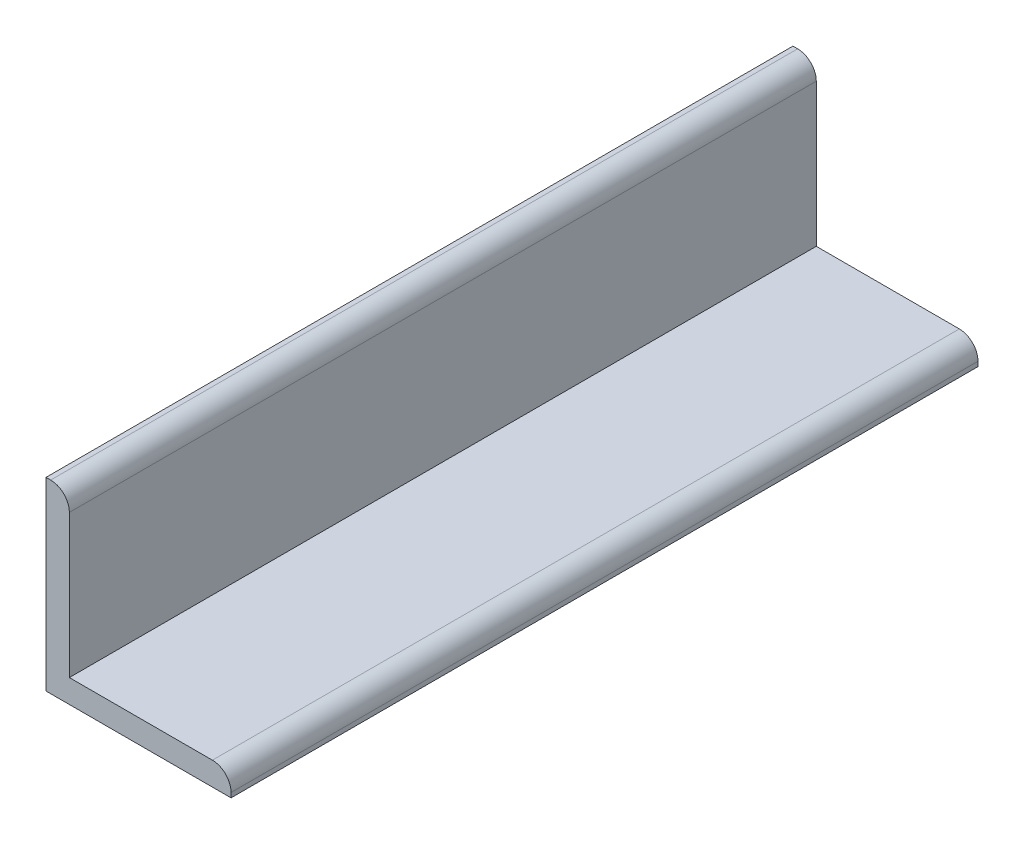
from build123d import *

# Parameters (mm, degrees)
BOSS_EXTRUDE1_DEPTH = 203.2


with BuildPart() as part:
    # Sketch1 → Boss-Extrude1 (new body)
    with BuildSketch(Plane.XY):
        with BuildLine():
            ThreePointArc((1.27, 50.342576275), (4.862102448, 48.854678723), (6.35, 45.262576275))
            Line((6.35, 45.262576275), (6.35, 6.35))
            Line((6.35, 6.35), (45.262576275, 6.35))
            ThreePointArc((45.262576275, 6.35), (48.854678723, 4.862102448), (50.342576275, 1.27))
            Line((50.342576275, 1.27), (50.342576275, 0))
            Line((50.342576275, 0), (0, 0))
            Line((0, 0), (0, 50.342576275))
            Line((0, 50.342576275), (1.27, 50.342576275))
        make_face()
    extrude(amount=BOSS_EXTRUDE1_DEPTH)


solid = part.part
